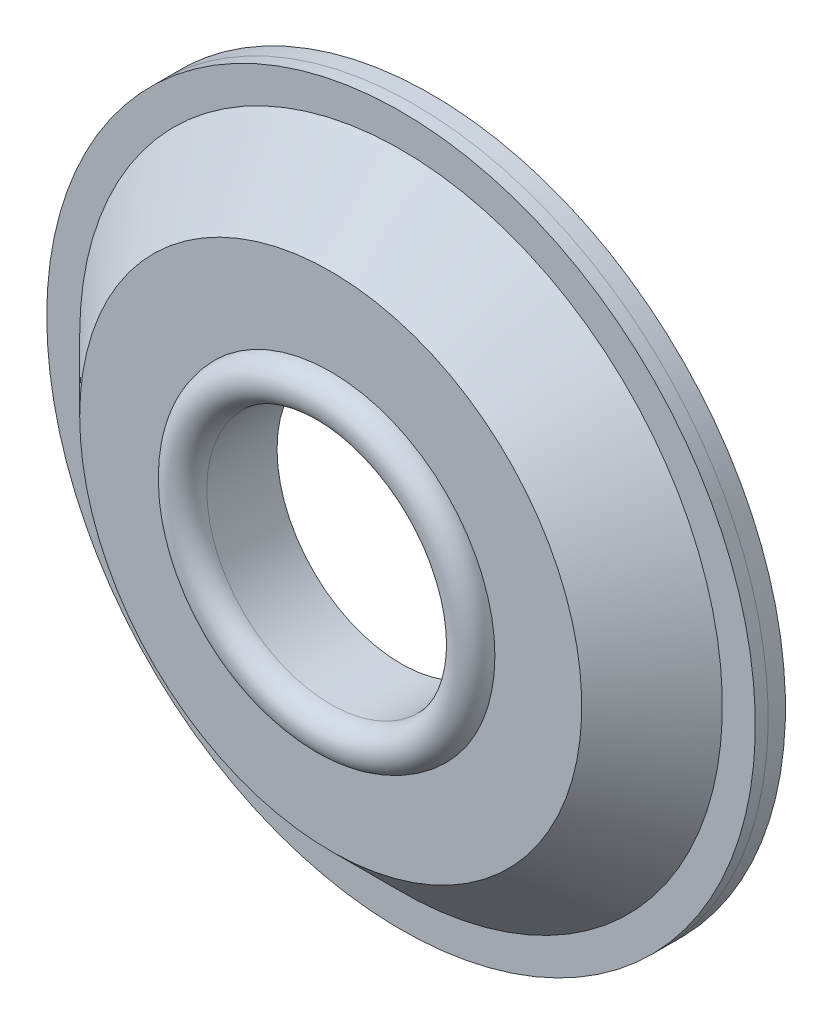
from build123d import *


with BuildPart() as part:
    # Sketch2 → Revolve1 (revolve)
    with BuildSketch(Plane(origin=(0, 0, 0), x_dir=(1, 0, 0), z_dir=(0, 1, 0))):
        Polygon((3.24375, -1.3890625), (2.704, -1.3890625), (2.704, -1.1350625), (4.854852255, -1.1350625), (6.243914755, 0.254), (7, 0.254), (7, 0), (6.349125, 0), (4.9600625, -1.3890625), align=None)
    revolve(axis=Axis((0, 0, -2.0850225), (0, 0, 1)))


with BuildPart() as body_2:
    # Sketch3 → Revolve2 (revolve)
    with BuildSketch(Plane(origin=(0, 0, 0), x_dir=(1, 0, 0), z_dir=(0, 1, 0))):
        with BuildLine():
            Line((2.45, -1.3890625), (2.45, 0))
            Line((2.45, 0), (3.56125, 0))
            Line((3.56125, 0), (3.56125, -0.635))
            Line((3.56125, -0.635), (3.629068894, -0.635))
            Line((3.629068894, -0.635), (4.383397306, 0.9826625))
            Line((4.383397306, 0.9826625), (4.9600625, -0.254))
            Line((4.9600625, -0.254), (5.809375, 0.5953125))
            Line((5.809375, 0.5953125), (7, 0.5953125))
            Line((7, 0.5953125), (7, 0.254))
            Line((7, 0.254), (6.243914755, 0.254))
            Line((6.243914755, 0.254), (4.854852255, -1.1350625))
            Line((4.854852255, -1.1350625), (2.704, -1.1350625))
            Line((2.704, -1.1350625), (2.704, -1.3890625))
            Line((2.704, -1.3890625), (3.24375, -1.3890625))
            ThreePointArc((3.24375, -1.3890625), (2.846875, -1.7859375), (2.45, -1.3890625))
        make_face()
    revolve(axis=Axis((0, 0, -2.0850225), (0, 0, 1)))


solid = Compound([part.part, body_2.part])
